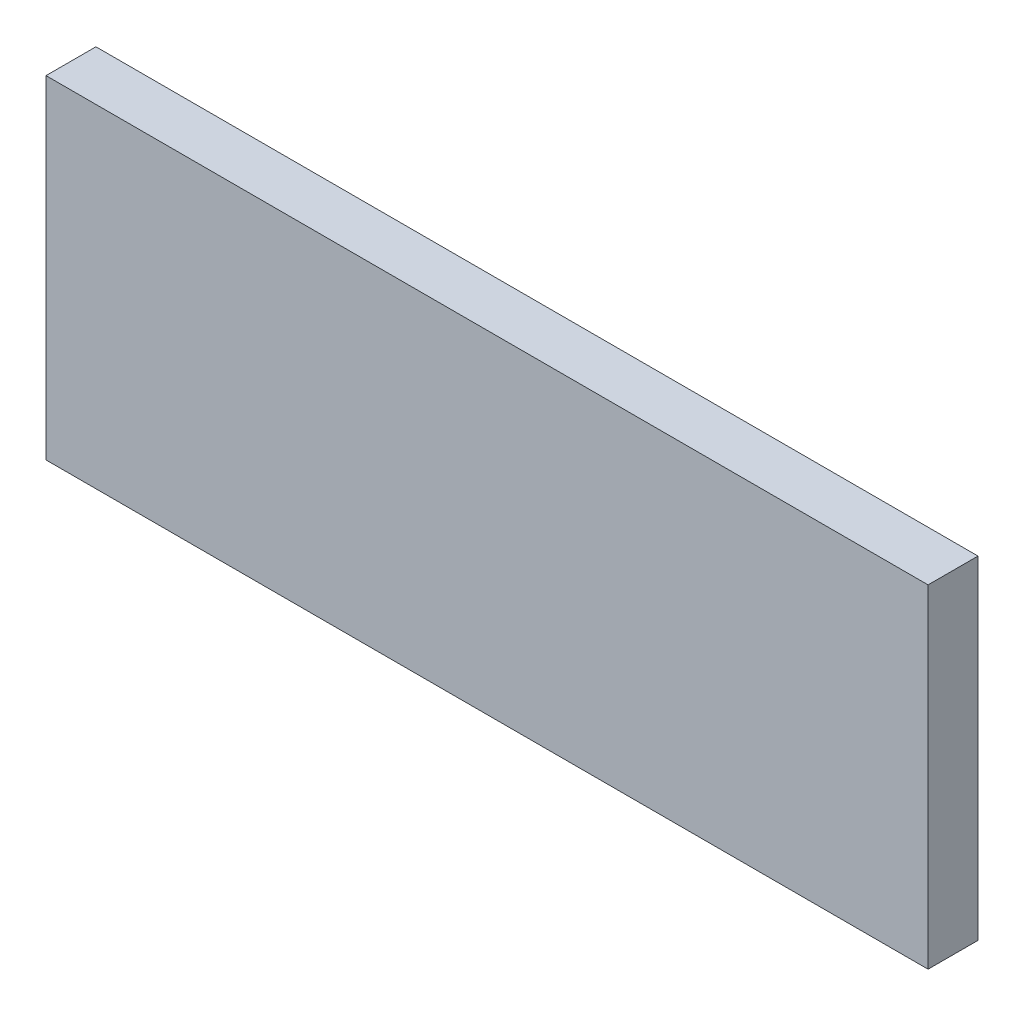
from build123d import *

# Parameters (mm, degrees)
SKETCH1_W           = 265
SKETCH1_H           = 100
BOSS_EXTRUDE1_DEPTH = 15


with BuildPart() as part:
    # Sketch1 → Boss-Extrude1 (new body)
    with BuildSketch(Plane.XY):
        Rectangle(SKETCH1_W, SKETCH1_H)
    extrude(amount=BOSS_EXTRUDE1_DEPTH)


solid = part.part
